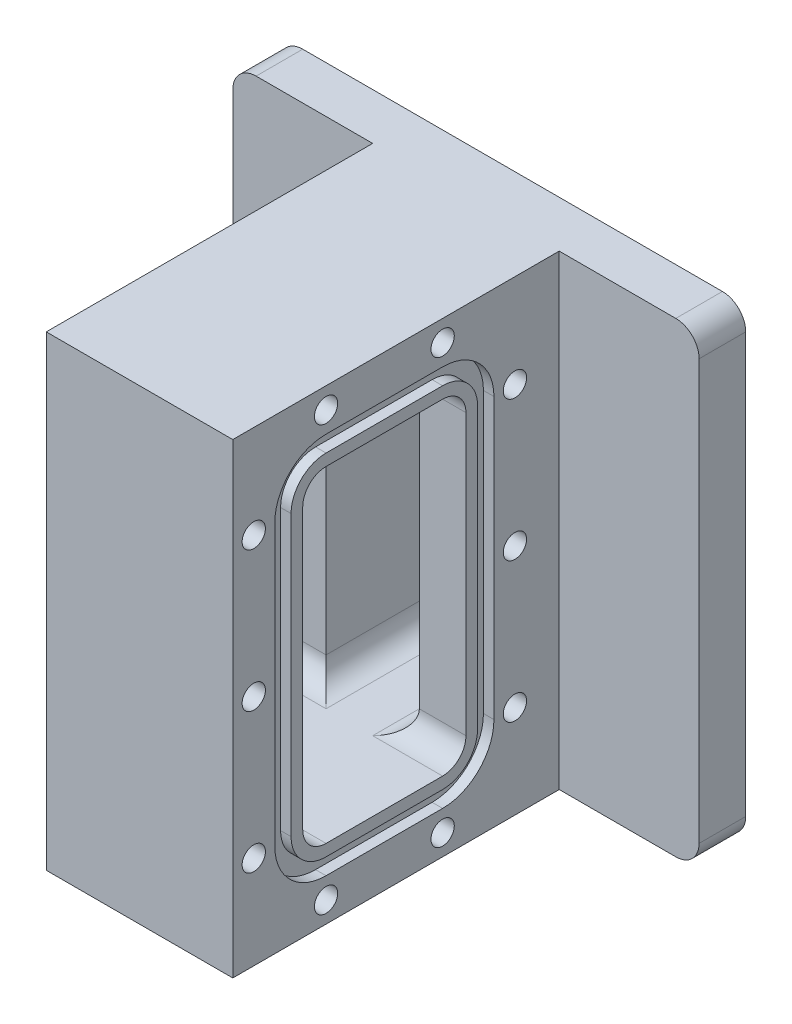
from build123d import *

# Parameters (mm, degrees)
SKETCH1_W                  = 79.99984
SKETCH1_H                  = 90.999818
BOSS_EXTRUDE1_DEPTH        = 67.7498645
BOSS_EXTRUDE2_DEPTH        = 32.2499355
CUT_EXTRUDE1_DEPTH         = 29.99994
SKETCH4_W                  = 29.99994
SKETCH4_H                  = 90.999818
CUT_EXTRUDE2_DEPTH         = 13.999972
SKETCH5_W                  = 69.99986
SKETCH5_H                  = 90.999818
CUT_EXTRUDE3_DEPTH         = 29.99994
SKETCH6_W                  = 39.99992
SKETCH6_H                  = 74.99985
BOSS_EXTRUDE3_DEPTH        = 2.2499955
SKETCH7_W                  = 19.99996
SKETCH7_H                  = 69.99986
CUT_EXTRUDE4_DEPTH         = 29.99994
SKETCH8_W                  = 39.99992
SKETCH8_H                  = 69.99986
CUT_EXTRUDE5_DEPTH         = 34.99993
SKETCH9_W                  = 46.999906
SKETCH9_H                  = 81.999836
SKETCH9_W_2                = 39.99992
SKETCH9_H_2                = 74.99985
CUT_EXTRUDE6_DEPTH         = 2.2499955
BOSS_EXTRUDE4_DEPTH        = 8.999982
F_10_CLEARANCE_HOLE1_D     = 4.99999
F_10_CLEARANCE_HOLE1_DEPTH = 6.999986
F_10_CLEARANCE_HOLE2_D     = 4.99999
F_10_CLEARANCE_HOLE2_DEPTH = 6.999986
FILLET1_R                  = 4.99999
FILLET2_R                  = 7.499985
FILLET3_R                  = 10.999978


with BuildPart() as part:
    # Sketch1 → Boss-Extrude1 (new body)
    with BuildSketch(Plane(origin=(99.9998, 0, 0), x_dir=(0, 0, -1), z_dir=(1, 0, 0))):
        with Locations((-39.99992, 45.499909)):
            Rectangle(SKETCH1_W, SKETCH1_H)
    extrude(amount=-BOSS_EXTRUDE1_DEPTH)

    # Sketch2 → Boss-Extrude2 (add)
    with BuildSketch(Plane.ZY.offset(-32.2499355)):
        Polygon((0, 90.999818), (23.999952, 90.999818), (23.999952, 8.999982), (70.999858, 8.999982), (70.999858, 90.999818), (79.99984, 90.999818), (79.99984, 0), (0, 0), align=None)
    extrude(amount=BOSS_EXTRUDE2_DEPTH)

    # Sketch3 → Cut-Extrude1 (cut)
    with BuildSketch(Plane.ZY):
        Polygon((70.999858, 8.999982), (23.999952, 8.999982), (23.999952, 0), (79.99984, 0), (79.99984, 90.999818), (70.999858, 90.999818), align=None)
    extrude(amount=-CUT_EXTRUDE1_DEPTH, mode=Mode.SUBTRACT)

    # Sketch4 → Cut-Extrude2 (cut)
    with BuildSketch(Plane.XY.offset(23.999952)):
        with Locations((14.99997, 45.499909)):
            Rectangle(SKETCH4_W, SKETCH4_H)
    extrude(amount=-CUT_EXTRUDE2_DEPTH, mode=Mode.SUBTRACT)

    # Sketch5 → Cut-Extrude3 (cut)
    with BuildSketch(Plane(origin=(99.9998, 0, 0), x_dir=(0, 0, -1), z_dir=(1, 0, 0))):
        with Locations((-44.99991, 45.499909)):
            Rectangle(SKETCH5_W, SKETCH5_H)
    extrude(amount=-CUT_EXTRUDE3_DEPTH, mode=Mode.SUBTRACT)

    # Sketch6 → Boss-Extrude3 (add)
    with BuildSketch(Plane.ZY.offset(-32.2499355)):
        with Locations((47.499905, 49.9999)):
            Rectangle(SKETCH6_W, SKETCH6_H)
    extrude(amount=BOSS_EXTRUDE3_DEPTH)

    # Sketch7 → Cut-Extrude4 (cut)
    with BuildSketch(Plane(origin=(0, 0, 0), x_dir=(-1, 0, 0), z_dir=(0, 0, -1))):
        with Locations((-49.9999, 49.9999)):
            Rectangle(SKETCH7_W, SKETCH7_H)
    extrude(amount=-CUT_EXTRUDE4_DEPTH, mode=Mode.SUBTRACT)

    # Sketch8 → Cut-Extrude5 (cut)
    with BuildSketch(Plane(origin=(0, 0, 29.99994), x_dir=(-1, 0, 0), z_dir=(0, 0, -1))):
        with Locations((-49.9999, 49.9999)):
            Rectangle(SKETCH8_W, SKETCH8_H)
    extrude(amount=-CUT_EXTRUDE5_DEPTH, mode=Mode.SUBTRACT)

    # Sketch9 → Cut-Extrude6 (cut)
    with BuildSketch(Plane(origin=(69.99986, 0, 0), x_dir=(0, 0, -1), z_dir=(1, 0, 0))):
        with Locations((-47.499905, 49.9999)):
            Rectangle(SKETCH9_W, SKETCH9_H)
        with Locations((-47.499905, 49.9999)):
            Rectangle(SKETCH9_W_2, SKETCH9_H_2, mode=Mode.SUBTRACT)
    extrude(amount=-CUT_EXTRUDE6_DEPTH, mode=Mode.SUBTRACT)

    # Sketch10 → Boss-Extrude4 (add)
    with BuildSketch(Plane(origin=(0, 90.999818, 0), x_dir=(-1, 0, 0), z_dir=(0, 1, 0))):
        Polygon((-29.99994, 9.99998), (0, 9.99998), (0, 0), (-99.9998, 0), (-99.9998, 9.99998), (-69.99986, 9.99998), (-69.99986, 79.99984), (-29.99994, 79.99984), align=None)
    extrude(amount=BOSS_EXTRUDE4_DEPTH)

    # #10 Clearance Hole1
    with Locations(Plane.ZY.offset(-29.99994)):
        with Locations((19.499961, 79.99984), (59.99988, 95.499809), (19.499961, 49.9999), (34.99993, 4.499991), (75.499849, 19.99996), (75.499849, 49.9999), (59.99988, 4.499991), (19.499961, 19.99996), (75.499849, 79.99984), (34.99993, 95.499809)):
            Hole(F_10_CLEARANCE_HOLE1_D / 2, depth=F_10_CLEARANCE_HOLE1_DEPTH)

    # #10 Clearance Hole2
    with Locations(Plane(origin=(69.99986, 0, 0), x_dir=(0, 0, -1), z_dir=(1, 0, 0))):
        with Locations((-59.99988, 4.499991), (-75.499849, 49.9999), (-59.99988, 95.499809), (-19.499961, 79.99984), (-19.499961, 19.99996), (-34.99993, 4.499991), (-19.499961, 49.9999), (-34.99993, 95.499809), (-75.499849, 79.99984), (-75.499849, 19.99996)):
            Hole(F_10_CLEARANCE_HOLE2_D / 2, depth=F_10_CLEARANCE_HOLE2_DEPTH)

    # Fillet1
    fillet1_edges = [part.edges().sort_by_distance(p)[0] for p in [
        (59.99988, 14.99997, 14.99997),
        (59.99988, 84.99983, 14.99997),
        (39.99992, 84.99983, 14.99997),
        (39.99992, 14.99997, 14.99997),
        (64.99987, 84.99983, 29.99994),
        (64.99987, 14.99997, 29.99994),
        (49.9999, 14.99997, 64.99987),
        (49.9999, 84.99983, 64.99987),
        (34.99993, 14.99997, 29.99994),
        (34.99993, 84.99983, 29.99994),
        (99.9998, 99.9998, 4.99999),
        (0, 99.9998, 4.99999),
        (0, 0, 4.99999),
        (99.9998, 0, 4.99999),
    ]]
    fillet(fillet1_edges, radius=FILLET1_R)

    # Fillet2
    fillet2_edges = [part.edges().sort_by_distance(p)[0] for p in [
        (68.87486225, 87.499825, 67.499865),
        (68.87486225, 87.499825, 27.499945),
        (68.87486225, 12.499975, 27.499945),
        (68.87486225, 12.499975, 67.499865),
        (31.12493775, 87.499825, 27.499945),
        (31.12493775, 12.499975, 27.499945),
        (31.12493775, 12.499975, 67.499865),
        (31.12493775, 87.499825, 67.499865),
    ]]
    fillet(fillet2_edges, radius=FILLET2_R)

    # Fillet3
    fillet3_edges = [part.edges().sort_by_distance(p)[0] for p in [
        (68.87486225, 8.999982, 70.999858),
        (68.87486225, 90.999818, 70.999858),
        (68.87486225, 90.999818, 23.999952),
        (68.87486225, 8.999982, 23.999952),
        (31.12493775, 8.999982, 23.999952),
        (31.12493775, 8.999982, 70.999858),
        (31.12493775, 90.999818, 70.999858),
        (31.12493775, 90.999818, 23.999952),
    ]]
    fillet(fillet3_edges, radius=FILLET3_R)


solid = part.part
